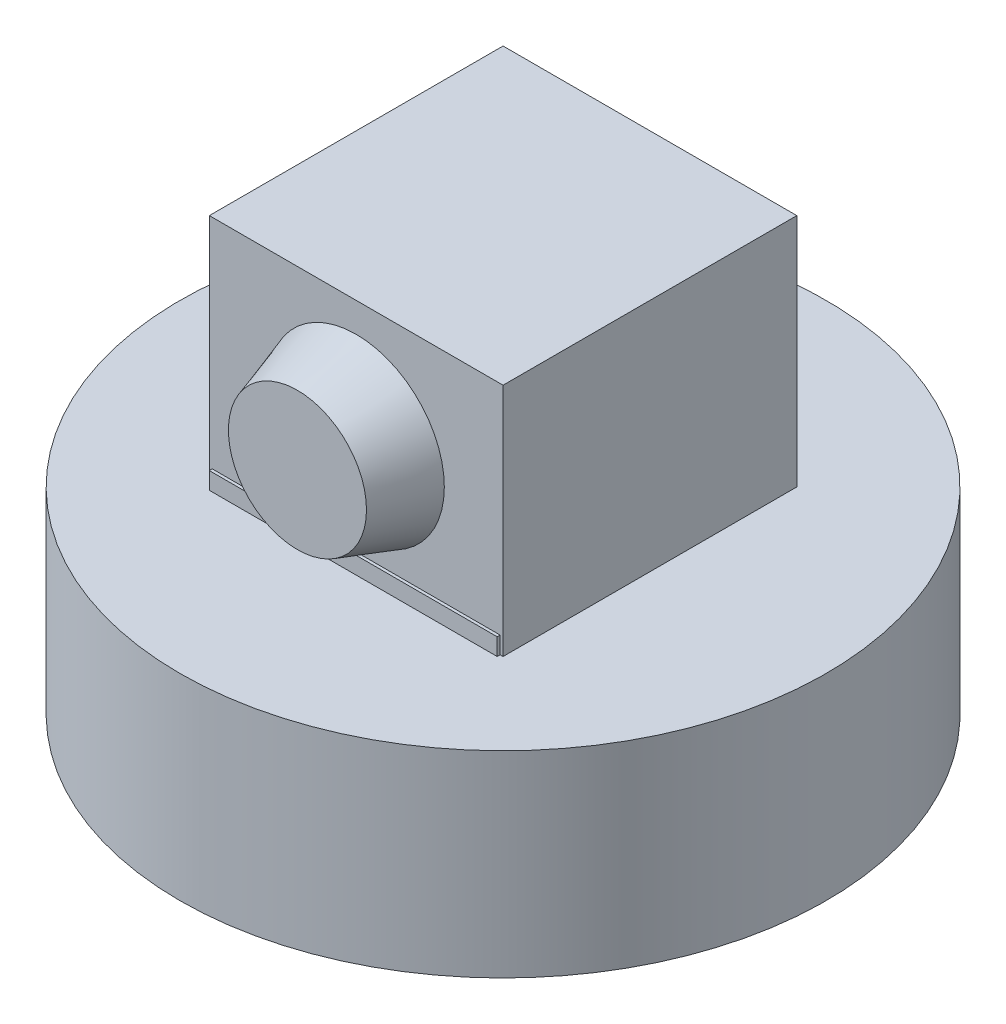
from build123d import *

# Parameters (mm, degrees)
SKETCH1_R           = 110
BOSS_EXTRUDE1_DEPTH = 12
SKETCH2_R           = 110
BOSS_EXTRUDE2_DEPTH = 55
SKETCH3_W           = 100
SKETCH3_H           = 100
BOSS_EXTRUDE3_DEPTH = 80
SKETCH4_R           = 30
BOSS_EXTRUDE4_DEPTH = 20
BOSS_EXTRUDE4_TAPER = 18
SHELL1_T            = -1
SKETCH6_W           = 98
SKETCH6_H           = 6.826689401
BOSS_EXTRUDE5_DEPTH = 100
SKETCH7_W           = 98
SKETCH7_H           = 74.173310599
BOSS_EXTRUDE6_DEPTH = 15
SKETCH8_W           = 98
SKETCH8_H           = 4.922598218
BOSS_EXTRUDE7_DEPTH = 83


with BuildPart() as part:
    # Sketch1 → Boss-Extrude1 (new body)
    with BuildSketch(Plane(origin=(0, 0, 0), x_dir=(1, 0, 0), z_dir=(0, 1, 0))):
        with Locations(Location((0, 0, 0), (0, 0, 270))):
            Circle(SKETCH1_R)
        with BuildLine():
            Line((-4.5, 8.309783391), (-4.5, 23.309783391))
            Line((-4.5, 23.309783391), (4.5, 23.309783391))
            Line((4.5, 23.309783391), (4.5, 8.309783391))
            ThreePointArc((4.5, 8.309783391), (9.45, 0), (4.5, -8.309783391))
            Line((4.5, -8.309783391), (4.5, -23.309783391))
            Line((4.5, -23.309783391), (-4.5, -23.309783391))
            Line((-4.5, -23.309783391), (-4.5, -8.309783391))
            ThreePointArc((-4.5, -8.309783391), (-9.45, 0), (-4.5, 8.309783391))
        make_face(mode=Mode.SUBTRACT)
    extrude(amount=BOSS_EXTRUDE1_DEPTH)

    # Sketch2 → Boss-Extrude2 (add)
    with BuildSketch(Plane(origin=(0, 12, 0), x_dir=(1, 0, 0), z_dir=(0, 1, 0))):
        with Locations(Location((0, 0, 0), (0, 0, 270))):
            Circle(SKETCH2_R)
    extrude(amount=BOSS_EXTRUDE2_DEPTH)

    # Sketch3 → Boss-Extrude3 (add)
    with BuildSketch(Plane(origin=(0, 67, 0), x_dir=(1, 0, 0), z_dir=(0, 1, 0))):
        Rectangle(SKETCH3_W, SKETCH3_H)
    extrude(amount=BOSS_EXTRUDE3_DEPTH)

    # Sketch4 → Boss-Extrude4 (add)
    with BuildSketch(Plane.XY.offset(50)):
        with Locations((0, 107)):
            Circle(SKETCH4_R)
    extrude(amount=BOSS_EXTRUDE4_DEPTH, taper=BOSS_EXTRUDE4_TAPER)

    # Shell1
    shell1_openings = [part.faces().sort_by_distance(p)[0] for p in [
        (0, 147, 0),
    ]]
    offset(amount=SHELL1_T, openings=shell1_openings, kind=Kind.INTERSECTION)

    # Sketch6 → Boss-Extrude5 (add)
    with BuildSketch(Plane.XY.offset(-49)):
        with Locations((0, 69.413344701)):
            Rectangle(SKETCH6_W, SKETCH6_H)
    extrude(amount=BOSS_EXTRUDE5_DEPTH)

    # Sketch7 → Boss-Extrude6 (add)
    with BuildSketch(Plane.XY.offset(-49)):
        with Locations((0, 109.913344701)):
            Rectangle(SKETCH7_W, SKETCH7_H)
    extrude(amount=BOSS_EXTRUDE6_DEPTH)

    # Sketch8 → Boss-Extrude7 (add)
    with BuildSketch(Plane.XY.offset(-34)):
        with Locations((0, 144.538700891)):
            Rectangle(SKETCH8_W, SKETCH8_H)
    extrude(amount=BOSS_EXTRUDE7_DEPTH)


solid = part.part
